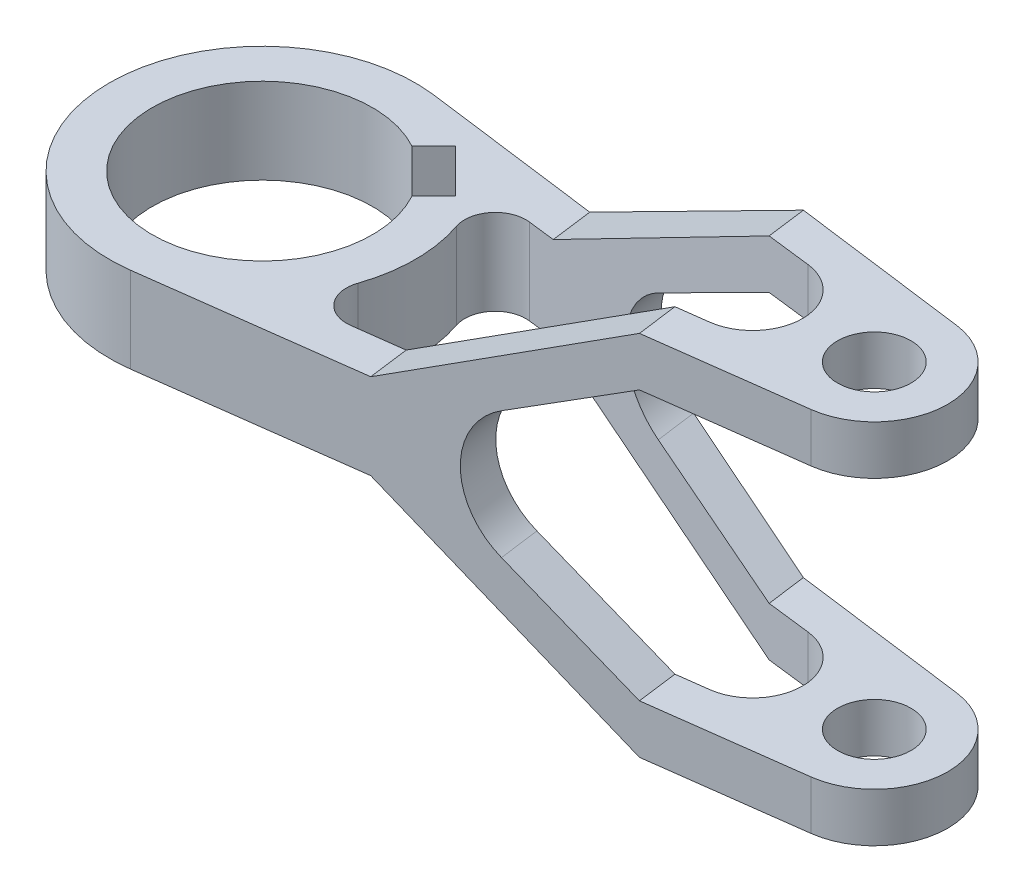
from build123d import *

# Parameters (mm, degrees)
BOSS_EXTRUDE1_DEPTH      = 30
BOSS_EXTRUDE1_DEPTH_BACK = 30
SKETCH1_R                = 18
SKETCH1_R_2              = 6
CUT_EXTRUDE1_DEPTH       = 124.310147564
CUT_EXTRUDE2_DEPTH       = 124.310147564
CUT_EXTRUDE3_DEPTH       = 121.573628958


with BuildPart() as part:
    # Sketch1 → Boss-Extrude1 (new, two sides: drawn at the far end of the back side and taken through both)
    with BuildSketch(Plane(origin=(0, 0, 0), x_dir=(1, 0, 0), z_dir=(0, 1, 0)).offset(-BOSS_EXTRUDE1_DEPTH_BACK)):
        with BuildLine():
            Line((3.25, 24.787849846), (101.56, 11.898167926))
            ThreePointArc((101.56, 11.898167926), (112, 0), (101.56, -11.898167926))
            Line((101.56, -11.898167926), (3.25, -24.787849846))
            ThreePointArc((3.25, -24.787849846), (-25, 0), (3.25, 24.787849846))
        make_face()
        Circle(SKETCH1_R, mode=Mode.SUBTRACT)
        with Locations((100, 0)):
            Circle(SKETCH1_R_2, mode=Mode.SUBTRACT)
        with BuildLine():
            Line((29.001639294, 14.62548865), (80.82543669, 8.361367746))
            ThreePointArc((80.82543669, 8.361367746), (88.001643881, 0.306494185), (80.906985676, -7.820298705))
            Line((80.906985676, -7.820298705), (29.051639294, -14.619189161))
            ThreePointArc((29.051639294, -14.619189161), (24.534716663, -12.831305196), (23.668032745, -8.051349326))
            ThreePointArc((23.668032745, -8.051349326), (25, 0), (23.668032745, 8.051349326))
            ThreePointArc((23.668032745, 8.051349326), (24.518792048, 12.811777483), (29.001639294, 14.62548865))
        make_face(mode=Mode.SUBTRACT)
    extrude(amount=BOSS_EXTRUDE1_DEPTH + BOSS_EXTRUDE1_DEPTH_BACK)

    # Sketch2 → Cut-Extrude1 (cut, through all)
    with BuildSketch(Plane(origin=(3.25, 0, 24.787849846), x_dir=(0.9915139938498094, 0, -0.1300000000000003), z_dir=(0.1300000000000003, 0, 0.9915139938498095))):
        Polygon((-25, 30), (-25, 7), (35, 7), (74.151399385, 30), align=None)
    cut_extrude1 = extrude(amount=-CUT_EXTRUDE1_DEPTH, mode=Mode.SUBTRACT)

    # Mirror1: Cut-Extrude1 across plane
    add(cut_extrude1.mirror(Plane.ZX), mode=Mode.SUBTRACT)

    # Sketch3 → Cut-Extrude2 (cut, through all)
    with BuildSketch(Plane(origin=(3.25, 0, 24.787849846), x_dir=(0.9915139938498094, 0, -0.1300000000000003), z_dir=(0.1300000000000003, 0, 0.9915139938498095))):
        with BuildLine():
            Line((111.151399385, -22), (111.151399385, 22))
            Line((111.151399385, 22), (74.151399385, 22))
            Line((74.151399385, 22), (54.046281618, 10.392304845))
            ThreePointArc((54.046281618, 10.392304845), (48.046281618, 0), (54.046281618, -10.392304845))
            Line((54.046281618, -10.392304845), (74.151399385, -22))
            Line((74.151399385, -22), (111.151399385, -22))
        make_face()
    extrude(amount=-CUT_EXTRUDE2_DEPTH, mode=Mode.SUBTRACT)

    # Sketch4 → Cut-Extrude3 (cut, through all)
    with BuildSketch(Plane(origin=(0, 7, 0), x_dir=(1, 0, 0), z_dir=(0, 1, 0))):
        with BuildLine():
            Line((8.691485355, 15.762553167), (12.227019261, 19.298087073))
            Line((12.227019261, 19.298087073), (19.298087073, 12.227019261))
            Line((19.298087073, 12.227019261), (15.762553167, 8.691485355))
            ThreePointArc((15.762553167, 8.691485355), (12.727922061, 12.727922061), (8.691485355, 15.762553167))
        make_face()
    extrude(amount=-CUT_EXTRUDE3_DEPTH, mode=Mode.SUBTRACT)


solid = part.part
